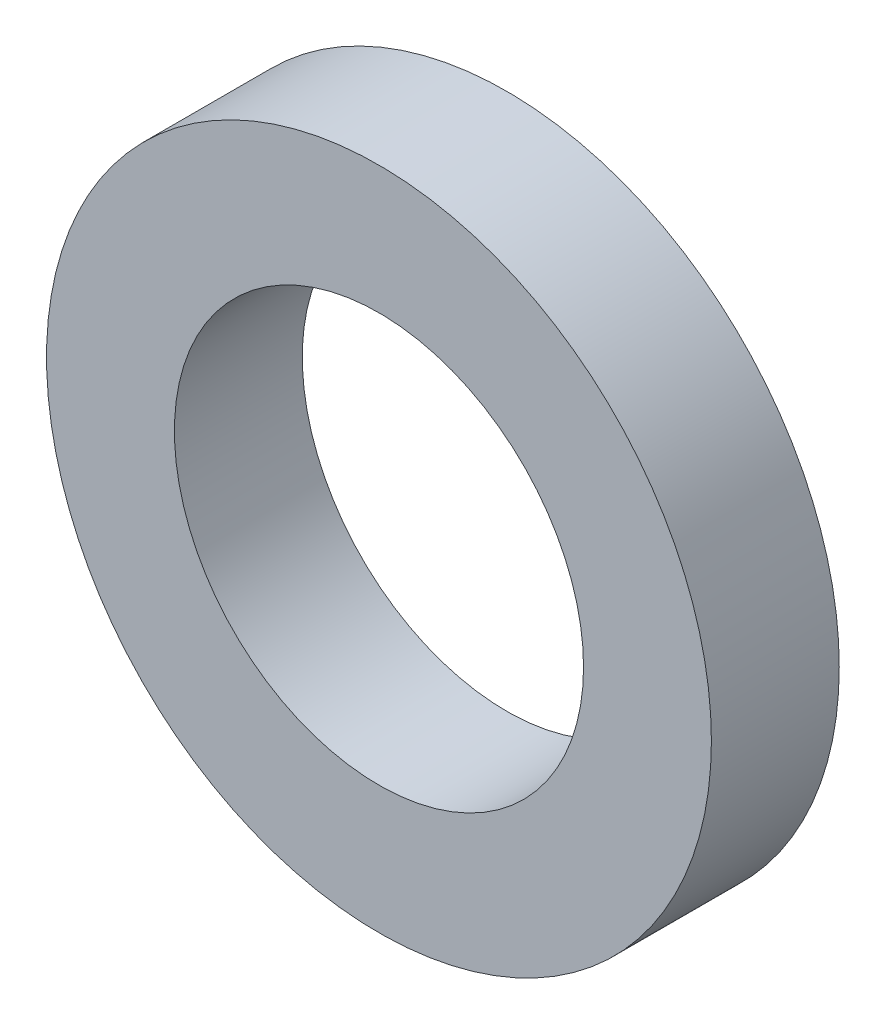
from build123d import *

# Parameters (mm, degrees)
SKETCH1_R           = 2.6
SKETCH1_R_2         = 1.6
BOSS_EXTRUDE1_DEPTH = 1


with BuildPart() as part:
    # Sketch1 → Boss-Extrude1 (new body)
    with BuildSketch(Plane.XY):
        Circle(SKETCH1_R)
        Circle(SKETCH1_R_2, mode=Mode.SUBTRACT)
    extrude(amount=BOSS_EXTRUDE1_DEPTH)


solid = part.part
